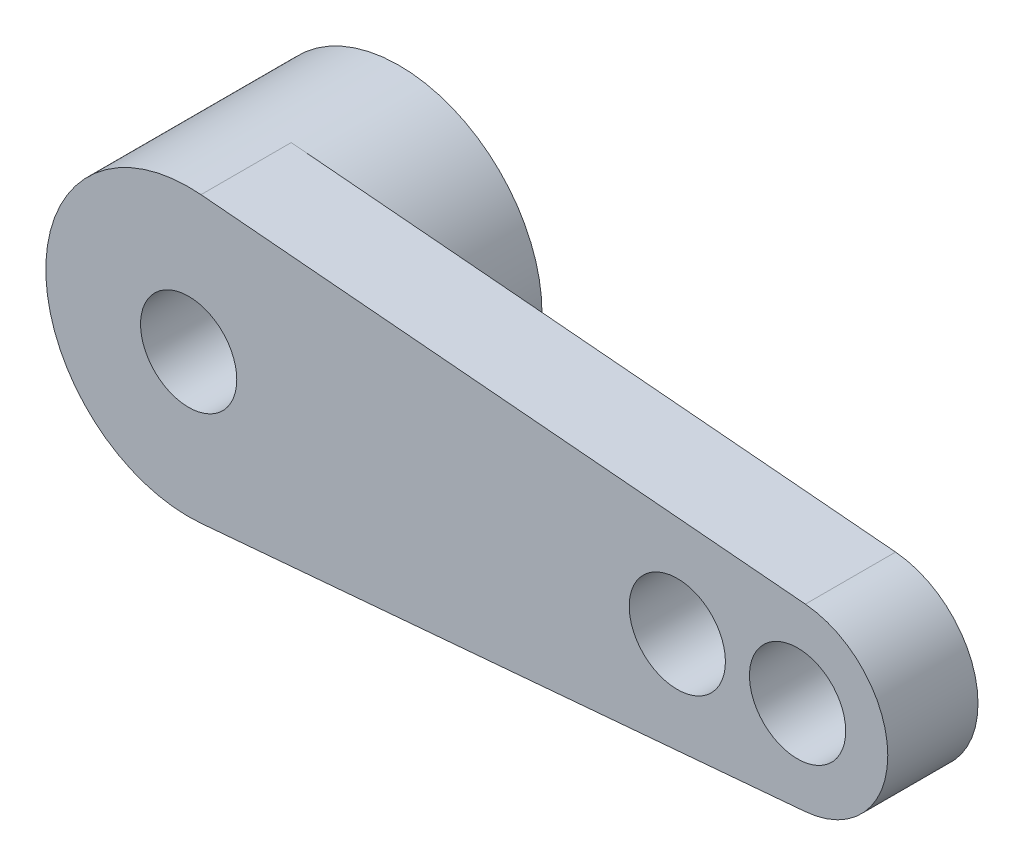
from build123d import *

# Parameters (mm, degrees)
SKETCH1_R           = 1.6
SKETCH1_R_2         = 2.5
BOSS_EXTRUDE1_DEPTH = 3
BOSS_EXTRUDE2_START = -4
SKETCH1_3_R         = 4.75
SKETCH1_3_R_2       = 2.5
BOSS_EXTRUDE2_DEPTH = 4
CUT_EXTRUDE1_DEPTH  = 4
BOSS_EXTRUDE3_START = -3
SKETCH3_R           = 2.5
SKETCH3_R_2         = 1.6
BOSS_EXTRUDE3_DEPTH = 3


with BuildPart() as part:
    # Sketch1 → Boss-Extrude1 (new body)
    with BuildSketch(Plane.XY):
        with BuildLine():
            Line((20.509259259, 2.988776445), (0.410493827, 4.732229371))
            ThreePointArc((0.410493827, 4.732229371), (-4.75, 0), (0.410493827, -4.732229371))
            Line((0.410493827, -4.732229371), (20.509259259, -2.988776445))
            ThreePointArc((20.509259259, -2.988776445), (23.25, 0), (20.509259259, 2.988776445))
        make_face()
        with Locations((16.25, 0)):
            Circle(SKETCH1_R, mode=Mode.SUBTRACT)
        Circle(SKETCH1_R_2, mode=Mode.SUBTRACT)
        with Locations((20.25, 0)):
            Circle(SKETCH1_R, mode=Mode.SUBTRACT)
    extrude(amount=BOSS_EXTRUDE1_DEPTH)

    # Sketch1<3> → Boss-Extrude2 (add)
    with BuildSketch(Plane.XY.offset(BOSS_EXTRUDE2_START)):
        with Locations(Location((0, 0, 0), (0, 0, 85.042328816))):
            Circle(SKETCH1_3_R)
        Circle(SKETCH1_3_R_2, mode=Mode.SUBTRACT)
    extrude(amount=BOSS_EXTRUDE2_DEPTH)

    # Sketch2 → Cut-Extrude1 (cut)
    with BuildSketch(Plane(origin=(0, 0, -4), x_dir=(-1, 0, 0), z_dir=(0, 0, -1))):
        Polygon((-0.133339862, 3), (-0.290232285, 2.483095894), (-0.562101943, 2.9498849), (-0.821593281, 2.888384323), (-0.855050358, 2.349231552), (-1.227240688, 2.740740742), (-1.465554394, 2.6210551), (-1.373772445, 2.088719529), (-1.826218569, 2.383842541), (-2.03050709, 2.212424118), (-1.818434104, 1.715604095), (-2.326744534, 1.898430771), (-2.485994623, 1.684520779), (-2.165063509, 1.25), (-2.701835099, 1.310674107), (-2.807461542, 1.065804489), (-2.394973781, 0.717008082), (-2.931269035, 0.652258663), (-2.977577483, 0.389630403), (-2.495770396, 0.145362072), (-3.002677498, -0.041320215), (-2.987171451, -0.307548759), (-2.462019383, -0.434120444), (-2.91221084, -0.732671509), (-2.835726233, -0.988147888), (-2.295540267, -0.990199415), (-2.664746142, -1.384524292), (-2.53140628, -1.615475708), (-2.005307982, -1.492896479), (-2.27362429, -1.961737012), (-2.090617559, -2.155712815), (-1.606969024, -1.915111108), (-1.759930764, -2.433191983), (-1.537123105, -2.579734886), (-1.121997951, -2.234081601), (-1.151358915, -2.773472944), (-0.900761945, -2.864682781), (-0.576539677, -2.432612176), (-0.480717008, -2.96423526), (-0.215840477, -2.995194886), (0, -2.5), (0.215840477, -2.995194886), (0.480717008, -2.96423526), (0.576539677, -2.432612176), (0.900761945, -2.864682781), (1.151358915, -2.773472944), (1.121997951, -2.234081601), (1.537123105, -2.579734886), (1.759930764, -2.433191983), (1.606969024, -1.915111108), (2.090617559, -2.155712815), (2.27362429, -1.961737012), (2.005307982, -1.492896479), (2.53140628, -1.615475708), (2.664746142, -1.384524292), (2.295540267, -0.990199415), (2.835726233, -0.988147888), (2.91221084, -0.732671509), (2.462019383, -0.434120444), (2.987171451, -0.307548759), (3.002677498, -0.041320215), (2.495770396, 0.145362072), (2.977577483, 0.389630403), (2.931269035, 0.652258663), (2.394973781, 0.717008082), (2.807461542, 1.065804489), (2.701835099, 1.310674107), (2.165063509, 1.25), (2.485994623, 1.684520779), (2.326744534, 1.898430771), (1.818434104, 1.715604095), (2.03050709, 2.212424118), (1.826218569, 2.383842541), (1.373772445, 2.088719529), (1.465554394, 2.6210551), (1.227240688, 2.740740742), (0.855050358, 2.349231552), (0.821593281, 2.888384323), (0.562101943, 2.9498849), (0.290232285, 2.483095894), (0.133339862, 3), align=None)
    extrude(amount=-CUT_EXTRUDE1_DEPTH, mode=Mode.SUBTRACT)

    # Sketch3 → Boss-Extrude3 (add)
    with BuildSketch(Plane.XY.offset(3).offset(BOSS_EXTRUDE3_START)):
        Circle(SKETCH3_R)
        Circle(SKETCH3_R_2, mode=Mode.SUBTRACT)
    extrude(amount=BOSS_EXTRUDE3_DEPTH)


solid = part.part
